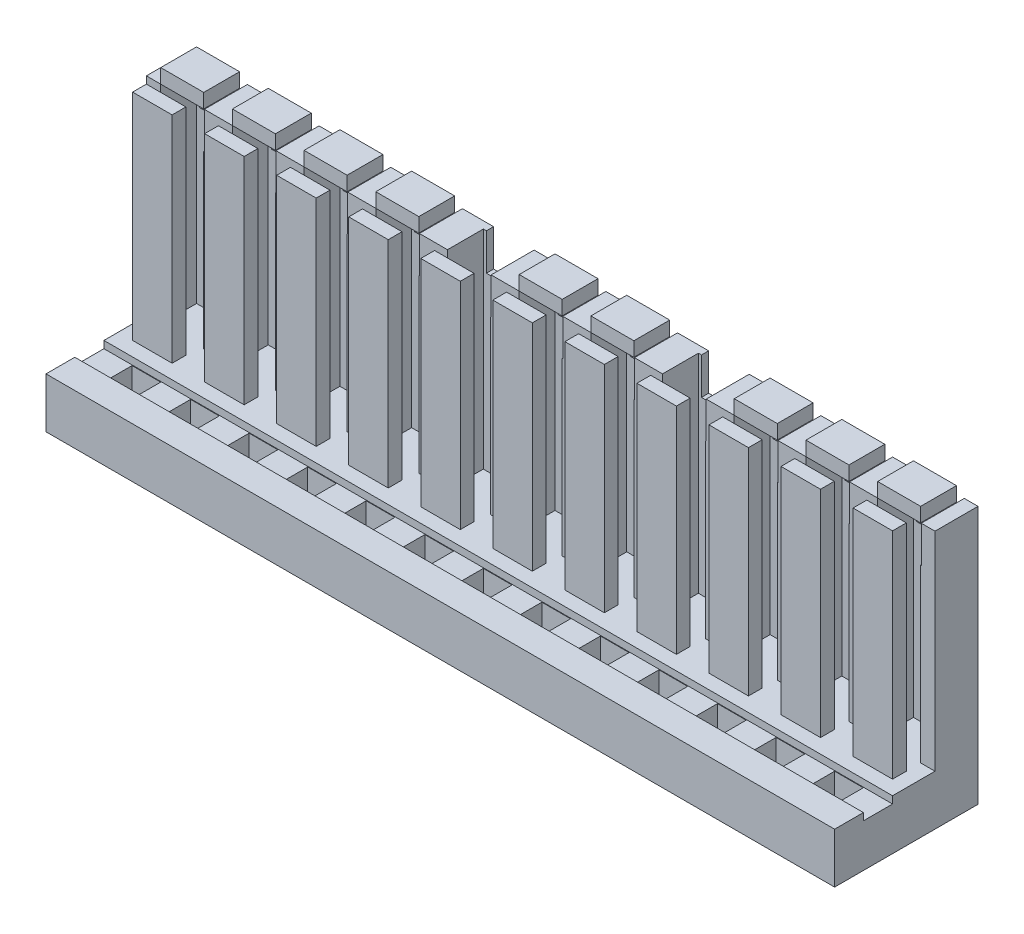
from build123d import *

# Parameters (mm, degrees)
SKETCH1_W             = 55
SKETCH1_H             = 10
BOSS_EXTRUDE1_DEPTH   = 18
SKETCH2_W             = 55
SKETCH2_H             = 7
CUT_EXTRUDE2_DEPTH    = 15
SKETCH3_W             = 2
SKETCH3_H             = 2
CUT_EXTRUDE3_DEPTH    = 2
SKETCH4_W             = 55
SKETCH4_H             = 2.008800787
BOSS_EXTRUDE2_DEPTH   = 0.5
SKETCH7_W             = 55
SKETCH7_H             = 2.959877421
BOSS_EXTRUDE3_DEPTH   = 0.5
SKETCH8_W             = 3
SKETCH8_H             = 14.5
CUT_EXTRUDE5_DEPTH    = 2.5
SKETCH9_W             = 2.82948436
SKETCH9_H             = 2.562088611
CUT_EXTRUDE6_DEPTH    = 59.72818744
SKETCH10_W            = 3
SKETCH10_H            = 2.5
BOSS_EXTRUDE4_DEPTH   = 1
BOSS_EXTRUDE4_2_DEPTH = 1
BOSS_EXTRUDE4_3_DEPTH = 1
BOSS_EXTRUDE4_4_DEPTH = 1
BOSS_EXTRUDE4_5_DEPTH = 1
BOSS_EXTRUDE4_6_DEPTH = 1
BOSS_EXTRUDE4_7_DEPTH = 1
BOSS_EXTRUDE4_8_DEPTH = 1
BOSS_EXTRUDE4_9_DEPTH = 1
SKETCH11_W            = 2.754842856
SKETCH11_H            = 0.959877421
SKETCH11_W_2          = 2.754842855
BOSS_EXTRUDE5_DEPTH   = 15


with BuildPart() as part:
    # Sketch1 → Boss-Extrude1 (new body)
    with BuildSketch(Plane(origin=(0, 0, 0), x_dir=(1, 0, 0), z_dir=(0, 1, 0))):
        with Locations((27.5, 5)):
            Rectangle(SKETCH1_W, SKETCH1_H)
    extrude(amount=BOSS_EXTRUDE1_DEPTH)

    # Sketch2 → Cut-Extrude2 (cut)
    with BuildSketch(Plane(origin=(0, 18, 0), x_dir=(1, 0, 0), z_dir=(0, 1, 0))):
        with Locations((27.5, 3.5)):
            Rectangle(SKETCH2_W, SKETCH2_H)
    extrude(amount=-CUT_EXTRUDE2_DEPTH, mode=Mode.SUBTRACT)

    # Sketch3 → Cut-Extrude3 (cut)
    with BuildSketch(Plane(origin=(0, 3, 0), x_dir=(1, 0, 0), z_dir=(0, 1, 0))):
        with Locations((52, 3)):
            Rectangle(SKETCH3_W, SKETCH3_H)
        with Locations((47.916666667, 3)):
            Rectangle(SKETCH3_W, SKETCH3_H)
        with Locations((43.833333333, 3)):
            Rectangle(SKETCH3_W, SKETCH3_H)
        with Locations((39.75, 3)):
            Rectangle(SKETCH3_W, SKETCH3_H)
        with Locations((35.666666667, 3)):
            Rectangle(SKETCH3_W, SKETCH3_H)
        with Locations((31.583333333, 3)):
            Rectangle(SKETCH3_W, SKETCH3_H)
        with Locations((27.5, 3)):
            Rectangle(SKETCH3_W, SKETCH3_H)
        with Locations((23.416666667, 3)):
            Rectangle(SKETCH3_W, SKETCH3_H)
        with Locations((19.333333333, 3)):
            Rectangle(SKETCH3_W, SKETCH3_H)
        with Locations((15.25, 3)):
            Rectangle(SKETCH3_W, SKETCH3_H)
        with Locations((11.166666667, 3)):
            Rectangle(SKETCH3_W, SKETCH3_H)
        with Locations((7.083333333, 3)):
            Rectangle(SKETCH3_W, SKETCH3_H)
        with Locations((3, 3)):
            Rectangle(SKETCH3_W, SKETCH3_H)
    extrude(amount=-CUT_EXTRUDE3_DEPTH, mode=Mode.SUBTRACT)

    # Sketch4 → Boss-Extrude2 (add)
    with BuildSketch(Plane(origin=(0, 3, 0), x_dir=(1, 0, 0), z_dir=(0, 1, 0))):
        with Locations((27.5, 1.004400394)):
            Rectangle(SKETCH4_W, SKETCH4_H)
    extrude(amount=BOSS_EXTRUDE2_DEPTH)

    # Sketch7 → Boss-Extrude3 (add)
    with BuildSketch(Plane(origin=(0, 3, 0), x_dir=(1, 0, 0), z_dir=(0, 1, 0))):
        with Locations((27.5, 5.52006129)):
            Rectangle(SKETCH7_W, SKETCH7_H)
    extrude(amount=BOSS_EXTRUDE3_DEPTH)

    # Sketch8 → Cut-Extrude5 (cut)
    with BuildSketch(Plane.XY.offset(-7)):
        with Locations((52.5, 10.75)):
            Rectangle(SKETCH8_W, SKETCH8_H)
        with Locations((47.5, 10.75)):
            Rectangle(SKETCH8_W, SKETCH8_H)
        with Locations((42.5, 10.75)):
            Rectangle(SKETCH8_W, SKETCH8_H)
        with Locations((37.5, 10.75)):
            Rectangle(SKETCH8_W, SKETCH8_H)
        with Locations((32.5, 10.75)):
            Rectangle(SKETCH8_W, SKETCH8_H)
        with Locations((27.5, 10.75)):
            Rectangle(SKETCH8_W, SKETCH8_H)
        with Locations((22.5, 10.75)):
            Rectangle(SKETCH8_W, SKETCH8_H)
        with Locations((17.5, 10.75)):
            Rectangle(SKETCH8_W, SKETCH8_H)
        with Locations((12.5, 10.75)):
            Rectangle(SKETCH8_W, SKETCH8_H)
        with Locations((7.5, 10.75)):
            Rectangle(SKETCH8_W, SKETCH8_H)
        with Locations((2.5, 10.75)):
            Rectangle(SKETCH8_W, SKETCH8_H)
    extrude(amount=-CUT_EXTRUDE5_DEPTH, mode=Mode.SUBTRACT)

    # Sketch9 → Cut-Extrude6 (cut, through all)
    with BuildSketch(Plane(origin=(0, 0, -10), x_dir=(-1, 0, 0), z_dir=(0, 0, -1))):
        with Locations((-52.629387682, 16.718955694)):
            Rectangle(SKETCH9_W, SKETCH9_H)
        with Locations((-47.629387682, 16.718955694)):
            Rectangle(SKETCH9_W, SKETCH9_H)
        with Locations((-42.629387682, 16.718955694)):
            Rectangle(SKETCH9_W, SKETCH9_H)
        with Locations((-37.629387682, 16.718955694)):
            Rectangle(SKETCH9_W, SKETCH9_H)
        with Locations((-32.629387682, 16.718955694)):
            Rectangle(SKETCH9_W, SKETCH9_H)
        with Locations((-27.629387682, 16.718955694)):
            Rectangle(SKETCH9_W, SKETCH9_H)
        with Locations((-22.629387682, 16.718955694)):
            Rectangle(SKETCH9_W, SKETCH9_H)
        with Locations((-17.629387682, 16.718955694)):
            Rectangle(SKETCH9_W, SKETCH9_H)
        with Locations((-12.629387682, 16.718955694)):
            Rectangle(SKETCH9_W, SKETCH9_H)
        with Locations((-7.629387682, 16.718955694)):
            Rectangle(SKETCH9_W, SKETCH9_H)
        with Locations((-2.629387682, 16.718955694)):
            Rectangle(SKETCH9_W, SKETCH9_H)
    extrude(amount=-CUT_EXTRUDE6_DEPTH, mode=Mode.SUBTRACT)

    # Sketch11 → Boss-Extrude5 (add)
    with BuildSketch(Plane(origin=(0, 3.5, 0), x_dir=(1, 0, 0), z_dir=(0, 1, 0))):
        with Locations((52.622578572, 5.52006129)):
            Rectangle(SKETCH11_W, SKETCH11_H)
        with Locations((47.598062858, 5.52006129)):
            Rectangle(SKETCH11_W, SKETCH11_H)
        with Locations((42.573547144, 5.52006129)):
            Rectangle(SKETCH11_W_2, SKETCH11_H)
        with Locations((37.549031429, 5.52006129)):
            Rectangle(SKETCH11_W, SKETCH11_H)
        with Locations((32.524515714, 5.52006129)):
            Rectangle(SKETCH11_W_2, SKETCH11_H)
        with Locations((27.5, 5.52006129)):
            Rectangle(SKETCH11_W, SKETCH11_H)
        with Locations((22.475484286, 5.52006129)):
            Rectangle(SKETCH11_W_2, SKETCH11_H)
        with Locations((17.450968571, 5.52006129)):
            Rectangle(SKETCH11_W, SKETCH11_H)
        with Locations((12.426452857, 5.52006129)):
            Rectangle(SKETCH11_W_2, SKETCH11_H)
        with Locations((7.401937142, 5.52006129)):
            Rectangle(SKETCH11_W, SKETCH11_H)
        with Locations((2.377421428, 5.52006129)):
            Rectangle(SKETCH11_W, SKETCH11_H)
    extrude(amount=BOSS_EXTRUDE5_DEPTH)


with BuildPart() as body_2:
    # Sketch10 → Boss-Extrude4 (new body)
    with BuildSketch(Plane(origin=(0, 18, 0), x_dir=(1, 0, 0), z_dir=(0, 1, 0))):
        with Locations((47.5, 8.25)):
            Rectangle(SKETCH10_W, SKETCH10_H)
    extrude(amount=BOSS_EXTRUDE4_DEPTH)


with BuildPart() as body_3:
    # Sketch10 → Boss-Extrude4 2 (new body)
    with BuildSketch(Plane(origin=(0, 18, 0), x_dir=(1, 0, 0), z_dir=(0, 1, 0))):
        with Locations((52.5, 8.25)):
            Rectangle(SKETCH10_W, SKETCH10_H)
    extrude(amount=BOSS_EXTRUDE4_2_DEPTH)


with BuildPart() as body_4:
    # Sketch10 → Boss-Extrude4 3 (new body)
    with BuildSketch(Plane(origin=(0, 18, 0), x_dir=(1, 0, 0), z_dir=(0, 1, 0))):
        with Locations((42.5, 8.25)):
            Rectangle(SKETCH10_W, SKETCH10_H)
    extrude(amount=BOSS_EXTRUDE4_3_DEPTH)


with BuildPart() as body_5:
    # Sketch10 → Boss-Extrude4 4 (new body)
    with BuildSketch(Plane(origin=(0, 18, 0), x_dir=(1, 0, 0), z_dir=(0, 1, 0))):
        with Locations((32.5, 8.25)):
            Rectangle(SKETCH10_W, SKETCH10_H)
    extrude(amount=BOSS_EXTRUDE4_4_DEPTH)


with BuildPart() as body_6:
    # Sketch10 → Boss-Extrude4 5 (new body)
    with BuildSketch(Plane(origin=(0, 18, 0), x_dir=(1, 0, 0), z_dir=(0, 1, 0))):
        with Locations((27.5, 8.25)):
            Rectangle(SKETCH10_W, SKETCH10_H)
    extrude(amount=BOSS_EXTRUDE4_5_DEPTH)


with BuildPart() as body_7:
    # Sketch10 → Boss-Extrude4 6 (new body)
    with BuildSketch(Plane(origin=(0, 18, 0), x_dir=(1, 0, 0), z_dir=(0, 1, 0))):
        with Locations((17.5, 8.25)):
            Rectangle(SKETCH10_W, SKETCH10_H)
    extrude(amount=BOSS_EXTRUDE4_6_DEPTH)


with BuildPart() as body_8:
    # Sketch10 → Boss-Extrude4 7 (new body)
    with BuildSketch(Plane(origin=(0, 18, 0), x_dir=(1, 0, 0), z_dir=(0, 1, 0))):
        with Locations((12.5, 8.25)):
            Rectangle(SKETCH10_W, SKETCH10_H)
    extrude(amount=BOSS_EXTRUDE4_7_DEPTH)


with BuildPart() as body_9:
    # Sketch10 → Boss-Extrude4 8 (new body)
    with BuildSketch(Plane(origin=(0, 18, 0), x_dir=(1, 0, 0), z_dir=(0, 1, 0))):
        with Locations((7.5, 8.25)):
            Rectangle(SKETCH10_W, SKETCH10_H)
    extrude(amount=BOSS_EXTRUDE4_8_DEPTH)


with BuildPart() as body_10:
    # Sketch10 → Boss-Extrude4 9 (new body)
    with BuildSketch(Plane(origin=(0, 18, 0), x_dir=(1, 0, 0), z_dir=(0, 1, 0))):
        with Locations((2.5, 8.25)):
            Rectangle(SKETCH10_W, SKETCH10_H)
    extrude(amount=BOSS_EXTRUDE4_9_DEPTH)


solid = Compound([part.part, body_2.part, body_3.part, body_4.part, body_5.part, body_6.part, body_7.part, body_8.part, body_9.part, body_10.part])
